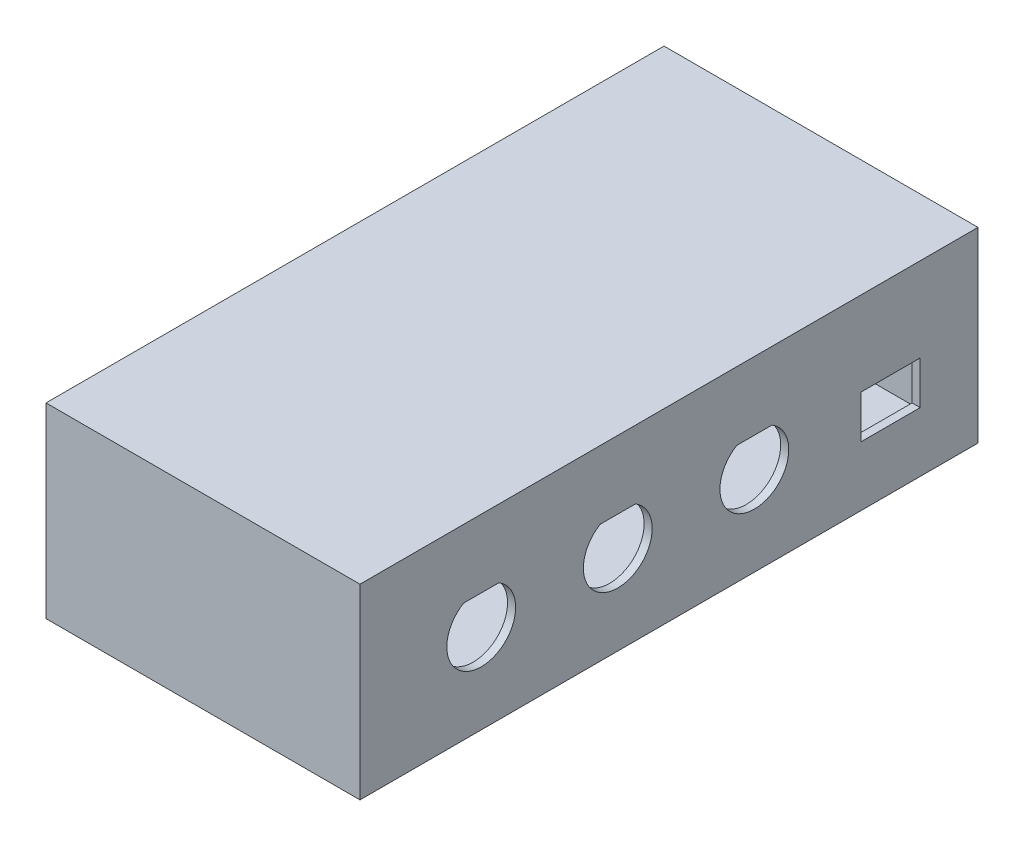
from build123d import *

# Parameters (mm, degrees)
SKETCH1_W       = 56.9
SKETCH1_H       = 111.95
MAINBODY_DEPTH  = 31.75
SHELL1_T        = 1.5
USBCUTOUT_REACH = 106.338
SKETCH4_W       = 11
SKETCH4_H       = 8
BNCCUTOUT_REACH = 106.338


with BuildPart() as part:
    # Sketch1 → MainBody (new body)
    with BuildSketch(Plane(origin=(0, 0, 0), x_dir=(1, 0, 0), z_dir=(0, 1, 0))):
        with Locations((-1030.101436168, 22.339371288)):
            Rectangle(SKETCH1_W, SKETCH1_H)
    extrude(amount=MAINBODY_DEPTH)

    # Shell1
    shell1_openings = [part.faces().sort_by_distance(p)[0] for p in [
        (-1058.551436168, 15.875, -22.339371288),
    ]]
    offset(amount=SHELL1_T, openings=shell1_openings, kind=Kind.INTERSECTION)

    # Sketch4 → USBCutout (cut, up to next)
    with BuildSketch(Plane(origin=(-1000.151436168, 0, 0), x_dir=(0, 0, -1), z_dir=(1, 0, 0)), mode=Mode.PRIVATE) as usbcutout_sk1:
        with Locations((63.554743949, 13.594071179)):
            Rectangle(SKETCH4_W, SKETCH4_H)
    usbcutout_tool1 = extrude(usbcutout_sk1.sketch, amount=-USBCUTOUT_REACH, mode=Mode.PRIVATE) & part.part
    add(usbcutout_tool1.solids().sort_by_distance((-1000.151436, 13.594071, -63.554744))[0], mode=Mode.SUBTRACT)

    # Sketch3 → BNCCutout (cut, up to next)
    with BuildSketch(Plane(origin=(-1000.151436168, 0, 0), x_dir=(0, 0, -1), z_dir=(1, 0, 0)), mode=Mode.PRIVATE) as bnccutout_sk1:
        with BuildLine():
            Line((-15.858242347, 20.56132), (-9.313015078, 20.56132))
            ThreePointArc((-9.313015078, 20.56132), (-12.585628712, 8.66132), (-15.858242347, 20.56132))
        make_face()
    bnccutout_tool1 = extrude(bnccutout_sk1.sketch, amount=-BNCCUTOUT_REACH, mode=Mode.PRIVATE) & part.part
    # Sketch3 → BNCCutout (cut, up to next)
    with BuildSketch(Plane(origin=(-1000.151436168, 0, 0), x_dir=(0, 0, -1), z_dir=(1, 0, 0)), mode=Mode.PRIVATE) as bnccutout_sk2:
        with BuildLine():
            Line((9.541757653, 20.56132), (16.086984922, 20.56132))
            ThreePointArc((16.086984922, 20.56132), (12.814371288, 8.66132), (9.541757653, 20.56132))
        make_face()
    bnccutout_tool2 = extrude(bnccutout_sk2.sketch, amount=-BNCCUTOUT_REACH, mode=Mode.PRIVATE) & part.part
    # Sketch3 → BNCCutout (cut, up to next)
    with BuildSketch(Plane(origin=(-1000.151436168, 0, 0), x_dir=(0, 0, -1), z_dir=(1, 0, 0)), mode=Mode.PRIVATE) as bnccutout_sk3:
        with BuildLine():
            Line((34.941757653, 20.56132), (41.486984922, 20.56132))
            ThreePointArc((41.486984922, 20.56132), (38.214371288, 8.66132), (34.941757653, 20.56132))
        make_face()
    bnccutout_tool3 = extrude(bnccutout_sk3.sketch, amount=-BNCCUTOUT_REACH, mode=Mode.PRIVATE) & part.part
    add(bnccutout_tool1.solids().sort_by_distance((-1000.151436, 14.873929, 12.585629))[0], mode=Mode.SUBTRACT)
    add(bnccutout_tool2.solids().sort_by_distance((-1000.151436, 14.873929, -12.814371))[0], mode=Mode.SUBTRACT)
    add(bnccutout_tool3.solids().sort_by_distance((-1000.151436, 14.873929, -38.214371))[0], mode=Mode.SUBTRACT)


solid = part.part
